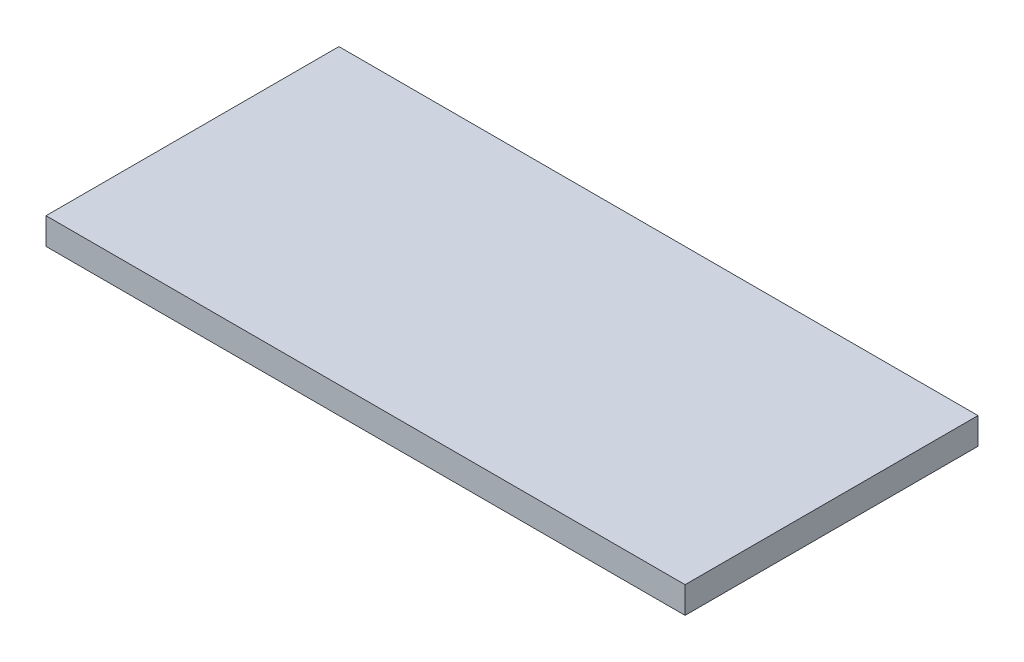
from build123d import *

# Parameters (mm, degrees)
CROQUIS1_W              = 1200
CROQUIS1_H              = 550
SALIENTE_EXTRUIR1_DEPTH = 50


with BuildPart() as part:
    # Croquis1 → Saliente-Extruir1 (new body)
    with BuildSketch(Plane(origin=(0, 0, 0), x_dir=(1, 0, 0), z_dir=(0, 1, 0))):
        Rectangle(CROQUIS1_W, CROQUIS1_H)
    extrude(amount=SALIENTE_EXTRUIR1_DEPTH)


solid = part.part
